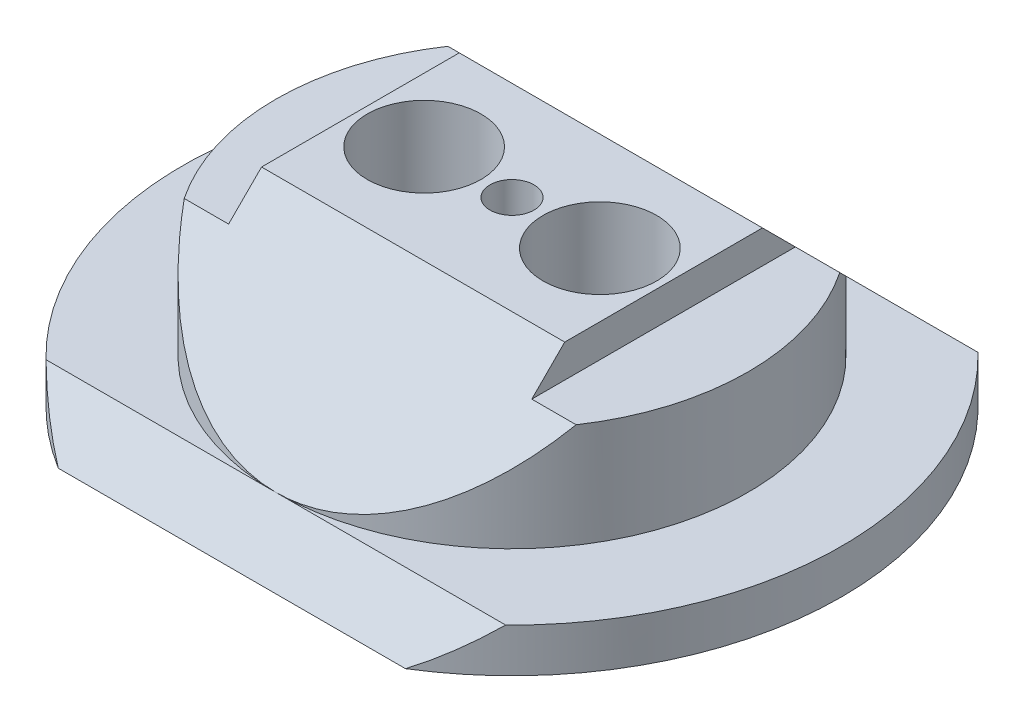
from build123d import *
from build123d.topology import SkipClean

# Parameters (mm, degrees)
SKETCH1_R                            = 30
BOSS_EXTRUDE1_DEPTH                  = 4
BOSS_EXTRUDE2_REACH                  = 44.615
BOSS_EXTRUDE2_END_RADIUS             = 30
BOSS_EXTRUDE2_DIRECTION_2_REACH      = 44.615
BOSS_EXTRUDE2_DIRECTION_2_END_RADIUS = 30
SKETCH3_OUTSIDE_W                    = 78.092
SKETCH3_OUTSIDE_H                    = 69.092
SKETCH3_OUTSIDE_R                    = 21.5
CUT_EXTRUDE2_DEPTH                   = 12.5
BOSS_EXTRUDE3_DEPTH                  = 18
BOSS_EXTRUDE4_DEPTH                  = 15
BOSS_EXTRUDE5_DEPTH                  = 15
CUT_EXTRUDE3_DEPTH                   = 44.292609069
CUT_EXTRUDE3_DEPTH_BACK              = 44.292609069
SKETCH8_R                            = 2
CUT_EXTRUDE8_DEPTH                   = 48.077064479
CUT_EXTRUDE8_DEPTH_BACK              = 48.077064479
CUT_EXTRUDE9_DEPTH                   = 59.659818207
CUT_EXTRUDE11_DEPTH                  = 20
CUT_EXTRUDE12_DEPTH                  = 20
CUT_EXTRUDE13_DEPTH                  = 20
CUT_EXTRUDE14_DEPTH                  = 44.292609069
CUT_EXTRUDE14_DEPTH_BACK             = 44.292609069
SKETCH25_W                           = 66.075437062
SKETCH25_H                           = 20.142243048
SKETCH26_R                           = 5.175
CUT_EXTRUDE15_DEPTH                  = 24
CUT_EXTRUDE17_DEPTH                  = 47.524187258
CUT_EXTRUDE17_DEPTH_BACK             = 47.524187258
SKETCH29_W                           = 7.7
SKETCH29_H                           = 3
CUT_EXTRUDE18_DEPTH                  = 47.524187258
CUT_EXTRUDE18_DEPTH_BACK             = 47.524187258
SKETCH31_W                           = 7.7
SKETCH31_H                           = 3
SKETCH34_R                           = 1.375
CUT_EXTRUDE21_DEPTH                  = 20
SKETCH35_R                           = 2
CUT_EXTRUDE22_DEPTH                  = 6
SKETCH37_R                           = 5
CUT_EXTRUDE23_DEPTH                  = 3


with BuildPart() as part:
    # Sketch1 → Boss-Extrude1 (new body)
    with BuildSketch(Plane(origin=(0, 0, 0), x_dir=(1, 0, 0), z_dir=(0, 1, 0))):
        with Locations(Location((0, 0, 0), (0, 0, 270))):
            Circle(SKETCH1_R)
    extrude(amount=BOSS_EXTRUDE1_DEPTH)

    # Boss-Extrude2: up to this cylinder (the profile starts inside it)
    with SkipClean():  # the faces are left unmerged after this step: merging them gives an invalid solid
        boss_extrude2_end = Plane(origin=(0, 9.396175, 0), z_dir=(0, -1, 0)) * Cylinder(BOSS_EXTRUDE2_END_RADIUS, 150.23, mode=Mode.PRIVATE)
        # Sketch2 → Boss-Extrude2 (add, up to the surface)
        with BuildSketch(Plane(origin=(0, 0, 0), x_dir=(0, 0, -1), z_dir=(1, 0, 0)), mode=Mode.PRIVATE) as boss_extrude2_sk1:
            Polygon((0, 4), (21.5, 4), (9, 16.5), (-9, 16.5), (-21.5, 4), align=None)
        boss_extrude2_tool1 = extrude(boss_extrude2_sk1.sketch, amount=BOSS_EXTRUDE2_REACH, mode=Mode.PRIVATE) & boss_extrude2_end
        add(boss_extrude2_tool1.solids().sort_by_distance((0, 9.396175, 0))[0])

    # Boss-Extrude2 direction 2: up to this cylinder (the profile starts inside it)
    with SkipClean():  # the faces are left unmerged after this step: merging them gives an invalid solid
        boss_extrude2_direction_2_end = Plane(origin=(0, 9.396175, 0), z_dir=(0, -1, 0)) * Cylinder(BOSS_EXTRUDE2_DIRECTION_2_END_RADIUS, 150.23, mode=Mode.PRIVATE)
        # Sketch2 → Boss-Extrude2 direction 2 (add, up to the surface)
        with BuildSketch(Plane(origin=(0, 0, 0), x_dir=(0, 0, -1), z_dir=(1, 0, 0)), mode=Mode.PRIVATE) as boss_extrude2_direction_2_sk1:
            Polygon((0, 4), (21.5, 4), (9, 16.5), (-9, 16.5), (-21.5, 4), align=None)
        boss_extrude2_direction_2_tool1 = extrude(boss_extrude2_direction_2_sk1.sketch, amount=-BOSS_EXTRUDE2_DIRECTION_2_REACH, mode=Mode.PRIVATE) & boss_extrude2_direction_2_end
        add(boss_extrude2_direction_2_tool1.solids().sort_by_distance((0, 9.396175, 0))[0])

    # SurfaceCut1
    split(bisect_by=Plane(origin=(0, 12.75, -12.75), x_dir=(1, 0, 0), z_dir=(0, 0.7071067811865558, -0.7071067811865392)), keep=Keep.BOTTOM)

    # SurfaceCut2
    split(bisect_by=Plane(origin=(0, 12.75, 12.75), x_dir=(1, 0, 0), z_dir=(0, 0.7071067811865509, 0.7071067811865442)), keep=Keep.BOTTOM)

    # Sketch3 outside → Cut-Extrude2 (cut)
    with BuildSketch(Plane(origin=(0, 4, 0), x_dir=(1, 0, 0), z_dir=(0, 1, 0))):
        Rectangle(SKETCH3_OUTSIDE_W, SKETCH3_OUTSIDE_H)
        Circle(SKETCH3_OUTSIDE_R, mode=Mode.SUBTRACT)
    extrude(amount=CUT_EXTRUDE2_DEPTH, mode=Mode.SUBTRACT)

    # Sketch5 → Boss-Extrude3 (add)
    with BuildSketch(Plane(origin=(0, 0, 0), x_dir=(-1, 0, 0), z_dir=(0, -1, 0))):
        Polygon((0, -6), (-17.5, -6), (-17.5, 6), (17.5, 6), (17.5, -6), align=None)
    extrude(amount=BOSS_EXTRUDE3_DEPTH)

    # Sketch6 → Boss-Extrude4 (add)
    with BuildSketch(Plane.XZ):
        Polygon((0, 15), (7, 15), (7, 6), (-7, 6), (-7, 15), align=None)
    extrude(amount=BOSS_EXTRUDE4_DEPTH)

    # Sketch7 → Boss-Extrude5 (add)
    with BuildSketch(Plane.XZ):
        Polygon((0, -15), (7, -15), (7, -6), (-7, -6), (-7, -15), align=None)
    extrude(amount=BOSS_EXTRUDE5_DEPTH)

    # Sketch8 → Cut-Extrude3 (cut, two sides: drawn at the far end of the back side and taken through both)
    with BuildSketch(Plane.XY.offset(-CUT_EXTRUDE3_DEPTH_BACK)):
        with Locations((-12.5, -12.5)):
            Circle(SKETCH8_R)
        with Locations((12.5, -12.5)):
            Circle(SKETCH8_R)
    extrude(amount=CUT_EXTRUDE3_DEPTH + CUT_EXTRUDE3_DEPTH_BACK, mode=Mode.SUBTRACT)

    # Sketch16 → Cut-Extrude8 (cut, two sides: drawn at the far end of the back side and taken through both)
    with BuildSketch(Plane.XY.offset(6).offset(-CUT_EXTRUDE8_DEPTH_BACK)):
        Polygon((17.5, -18), (17.5, -14.5), (14, -18), align=None)
        Polygon((-17.5, -18), (-14, -18), (-17.5, -14.5), align=None)
    extrude(amount=CUT_EXTRUDE8_DEPTH + CUT_EXTRUDE8_DEPTH_BACK, mode=Mode.SUBTRACT)

    # Sketch17 → Cut-Extrude9 (cut, through all)
    with BuildSketch(Plane(origin=(10.365975269, -9.674910251, -8.062425209), x_dir=(-0.3613483622370374, 0.337258471421235, -0.8693009171531012), z_dir=(0.6355070151731325, -0.5931398808282571, -0.49428323402354774))):
        Polygon((-2.372510104, -6.189601271), (7.980636686, -0.706686759), (7.980636686, -10.965829024), align=None)
    extrude(amount=CUT_EXTRUDE9_DEPTH, mode=Mode.SUBTRACT)

    # Sketch19 → Cut-Extrude11 (cut)
    with BuildSketch(Plane(origin=(-10.365975269, -9.674910251, -8.062425209), x_dir=(0.3613483622370374, 0.33725847142123494, -0.8693009171531012), z_dir=(0.6355070151731324, 0.5931398808282571, 0.4942832340235476))):
        Polygon((-2.372510104, -6.189601271), (7.980636686, -10.965829024), (7.980636686, -0.706686759), align=None)
    extrude(amount=-CUT_EXTRUDE11_DEPTH, mode=Mode.SUBTRACT)

    # Sketch20 → Cut-Extrude12 (cut)
    with BuildSketch(Plane(origin=(-10.365975269, -9.674910251, 8.062425209), x_dir=(-0.3613483622370374, -0.3372584714212349, -0.8693009171531013), z_dir=(0.6355070151731326, 0.593139880828257, -0.49428323402354757))):
        Polygon((2.372510104, -6.189601271), (-7.980636686, -0.706686759), (-7.980636686, -10.965829024), align=None)
    extrude(amount=-CUT_EXTRUDE12_DEPTH, mode=Mode.SUBTRACT)

    # Sketch21 → Cut-Extrude13 (cut)
    with BuildSketch(Plane(origin=(10.365975269, -9.674910251, 8.062425209), x_dir=(-0.3613483622370374, 0.3372584714212349, 0.8693009171531013), z_dir=(-0.6355070151731326, 0.593139880828257, -0.49428323402354757))):
        Polygon((-2.372510104, -6.189601271), (7.980636686, -0.706686759), (7.980636686, -10.965829024), align=None)
    extrude(amount=-CUT_EXTRUDE13_DEPTH, mode=Mode.SUBTRACT)

    # Sketch25 → Cut-Extrude14 (cut, two sides: drawn at the far end of the back side and taken through both)
    with BuildSketch(Plane.XY.offset(-CUT_EXTRUDE14_DEPTH_BACK)):
        with Locations((0, -10.071121524)):
            Rectangle(SKETCH25_W, SKETCH25_H)
    extrude(amount=CUT_EXTRUDE14_DEPTH + CUT_EXTRUDE14_DEPTH_BACK, mode=Mode.SUBTRACT)

    # Sketch26 → Cut-Extrude15 (cut)
    with BuildSketch(Plane(origin=(0, 16.5, 0), x_dir=(1, 0, 0), z_dir=(0, 1, 0))):
        with Locations(Location((-8, 0, 0), (0, 0, 270))):
            Circle(SKETCH26_R)
        with Locations(Location((8, 0, 0), (0, 0, 270))):
            Circle(SKETCH26_R)
    extrude(amount=-CUT_EXTRUDE15_DEPTH, mode=Mode.SUBTRACT)

    # Sketch29 → Cut-Extrude17 (cut, two sides: drawn at the far end of the back side and taken through both)
    with BuildSketch(Plane.XY.offset(6).offset(-CUT_EXTRUDE17_DEPTH_BACK)):
        with Locations((17.65, 15)):
            Rectangle(SKETCH29_W, SKETCH29_H)
    extrude(amount=CUT_EXTRUDE17_DEPTH + CUT_EXTRUDE17_DEPTH_BACK, mode=Mode.SUBTRACT)

    # Sketch31 → Cut-Extrude18 (cut, two sides: drawn at the far end of the back side and taken through both)
    with BuildSketch(Plane.XY.offset(6).offset(-CUT_EXTRUDE18_DEPTH_BACK)):
        with Locations((-17.65, 15)):
            Rectangle(SKETCH31_W, SKETCH31_H)
    extrude(amount=CUT_EXTRUDE18_DEPTH + CUT_EXTRUDE18_DEPTH_BACK, mode=Mode.SUBTRACT)

    # Sketch34 → Cut-Extrude21 (cut)
    with BuildSketch(Plane.XZ):
        with Locations(Location((0, 0, 0), (0, 0, 270))):
            Circle(SKETCH34_R)
    extrude(amount=-CUT_EXTRUDE21_DEPTH, mode=Mode.SUBTRACT)

    # Sketch35 → Cut-Extrude22 (cut)
    with BuildSketch(Plane(origin=(0, 16.5, 0), x_dir=(1, 0, 0), z_dir=(0, 1, 0))):
        with Locations(Location((0, 0, 0), (0, 0, 270))):
            Circle(SKETCH35_R)
    extrude(amount=-CUT_EXTRUDE22_DEPTH, mode=Mode.SUBTRACT)

    # Sketch37 → Cut-Extrude23 (cut)
    with BuildSketch(Plane.XZ):
        with Locations(Location((0, -15, 0), (0, 0, 270))):
            Circle(SKETCH37_R)
        with Locations(Location((0, 15, 0), (0, 0, 270))):
            Circle(SKETCH37_R)
        with Locations(Location((-22, 0, 0), (0, 0, 270))):
            Circle(SKETCH37_R)
        with Locations(Location((22, 0, 0), (0, 0, 270))):
            Circle(SKETCH37_R)
        with Locations(Location((-14, 12, 0), (0, 0, 270))):
            Circle(SKETCH37_R)
        with Locations(Location((14, 12, 0), (0, 0, 270))):
            Circle(SKETCH37_R)
        with Locations(Location((-14, -12, 0), (0, 0, 270))):
            Circle(SKETCH37_R)
        with Locations(Location((14, -12, 0), (0, 0, 270))):
            Circle(SKETCH37_R)
    extrude(amount=-CUT_EXTRUDE23_DEPTH, mode=Mode.SUBTRACT)


solid = part.part
